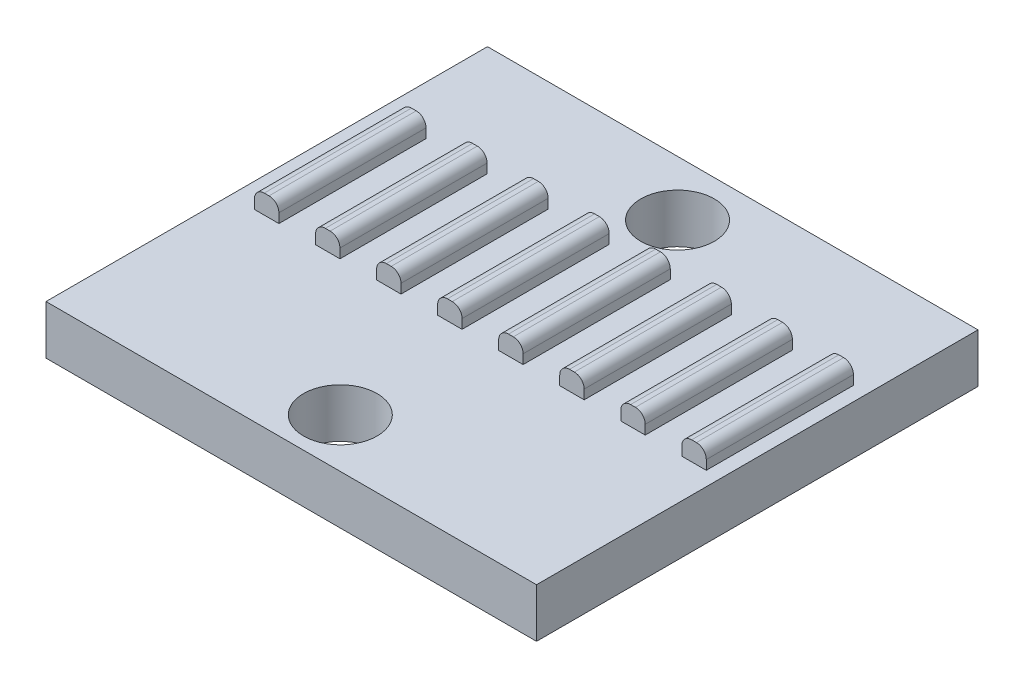
from build123d import *

# Parameters (mm, degrees)
SKETCH_1_W          = 20
SKETCH_1_H          = 18
EXTRUDE_1_DEPTH     = 2
SKETCH_6_W          = 0.995744681
SKETCH_6_H          = 6
EXTRUDE_4_DEPTH     = 0.78
EXTRUDE_4_2_DEPTH   = 0.78
SKETCH_6_W_2        = 0.99574468
EXTRUDE_4_3_DEPTH   = 0.78
EXTRUDE_4_4_DEPTH   = 0.78
EXTRUDE_4_5_DEPTH   = 0.78
EXTRUDE_4_6_DEPTH   = 0.78
EXTRUDE_4_7_DEPTH   = 0.78
EXTRUDE_4_8_DEPTH   = 0.78
FILLET_11_R         = 0.4
FILLET_12_R         = 0.4
FILLET_13_R         = 0.4
FILLET_14_R         = 0.4
FILLET_15_R         = 0.4
FILLET_16_R         = 0.4
FILLET_17_R         = 0.4
FILLET_18_R         = 0.4
FILLET_19_R         = 0.4
SKETCH_9_R          = 1.5
CUT_EXTRUDE_2_DEPTH = 10


with BuildPart() as part:
    # 草图1 → 凸台-拉伸1 (new body)
    with BuildSketch(Plane(origin=(0, 0, 0), x_dir=(1, 0, 0), z_dir=(0, 1, 0))):
        Rectangle(SKETCH_1_W, SKETCH_1_H)
    extrude(amount=EXTRUDE_1_DEPTH)

    # 草图9 → 切除-拉伸2 (cut)
    with BuildSketch(Plane(origin=(0, 2, 0), x_dir=(1, 0, 0), z_dir=(0, 1, 0))):
        with Locations(Location((0, -7, 0), (0, 0, 270))):
            Circle(SKETCH_9_R)
        with Locations(Location((0, 6.75, 0), (0, 0, 270))):
            Circle(SKETCH_9_R)
    extrude(amount=-CUT_EXTRUDE_2_DEPTH, mode=Mode.SUBTRACT)


with BuildPart() as body_2:
    # 草图6 → 凸台-拉伸4 (new body)
    with BuildSketch(Plane(origin=(0, 2, 0), x_dir=(1, 0, 0), z_dir=(0, 1, 0))):
        with Locations((8.923404255, 1.5)):
            Rectangle(SKETCH_6_W, SKETCH_6_H)
    extrude(amount=EXTRUDE_4_DEPTH)

    # 圆角19
    fillet_19_edges = [body_2.edges().sort_by_distance(p)[0] for p in [
        (8.425531915, 2.78, -1.5),
        (9.421276596, 2.78, -1.5),
    ]]
    fillet(fillet_19_edges, radius=FILLET_19_R)


with BuildPart() as body_3:
    # 草图6 → Extrude 4 2 (new body)
    with BuildSketch(Plane(origin=(0, 2, 0), x_dir=(1, 0, 0), z_dir=(0, 1, 0))):
        with Locations((6.434042554, 1.5)):
            Rectangle(SKETCH_6_W, SKETCH_6_H)
    extrude(amount=EXTRUDE_4_2_DEPTH)

    # 圆角18
    fillet_18_edges = [body_3.edges().sort_by_distance(p)[0] for p in [
        (5.936170213, 2.78, -1.5),
        (6.931914894, 2.78, -1.5),
    ]]
    fillet(fillet_18_edges, radius=FILLET_18_R)


with BuildPart() as body_4:
    # 草图6 → Extrude 4 3 (new body)
    with BuildSketch(Plane(origin=(0, 2, 0), x_dir=(1, 0, 0), z_dir=(0, 1, 0))):
        with Locations((3.944680851, 1.5)):
            Rectangle(SKETCH_6_W_2, SKETCH_6_H)
    extrude(amount=EXTRUDE_4_3_DEPTH)

    # 圆角17
    fillet_17_edges = [body_4.edges().sort_by_distance(p)[0] for p in [
        (3.446808511, 2.78, -1.5),
        (4.442553191, 2.78, -1.5),
    ]]
    fillet(fillet_17_edges, radius=FILLET_17_R)


with BuildPart() as body_5:
    # 草图6 → Extrude 4 4 (new body)
    with BuildSketch(Plane(origin=(0, 2, 0), x_dir=(1, 0, 0), z_dir=(0, 1, 0))):
        with Locations((1.455319149, 1.5)):
            Rectangle(SKETCH_6_W_2, SKETCH_6_H)
    extrude(amount=EXTRUDE_4_4_DEPTH)

    # 圆角16
    fillet_16_edges = [body_5.edges().sort_by_distance(p)[0] for p in [
        (0.957446809, 2.78, -1.5),
        (1.953191489, 2.78, -1.5),
    ]]
    fillet(fillet_16_edges, radius=FILLET_16_R)


with BuildPart() as body_6:
    # 草图6 → Extrude 4 5 (new body)
    with BuildSketch(Plane(origin=(0, 2, 0), x_dir=(1, 0, 0), z_dir=(0, 1, 0))):
        with Locations((-1.034042553, 1.5)):
            Rectangle(SKETCH_6_W, SKETCH_6_H)
    extrude(amount=EXTRUDE_4_5_DEPTH)

    # 圆角14
    fillet_14_edges = [body_6.edges().sort_by_distance(p)[0] for p in [
        (-1.531914894, 2.78, -1.5),
    ]]
    fillet(fillet_14_edges, radius=FILLET_14_R)

    # 圆角15
    fillet_15_edges = [body_6.edges().sort_by_distance(p)[0] for p in [
        (-0.536170213, 2.78, -1.5),
    ]]
    fillet(fillet_15_edges, radius=FILLET_15_R)


with BuildPart() as body_7:
    # 草图6 → Extrude 4 6 (new body)
    with BuildSketch(Plane(origin=(0, 2, 0), x_dir=(1, 0, 0), z_dir=(0, 1, 0))):
        with Locations((-3.523404256, 1.5)):
            Rectangle(SKETCH_6_W, SKETCH_6_H)
    extrude(amount=EXTRUDE_4_6_DEPTH)

    # 圆角13
    fillet_13_edges = [body_7.edges().sort_by_distance(p)[0] for p in [
        (-4.021276596, 2.78, -1.5),
        (-3.025531915, 2.78, -1.5),
    ]]
    fillet(fillet_13_edges, radius=FILLET_13_R)


with BuildPart() as body_8:
    # 草图6 → Extrude 4 7 (new body)
    with BuildSketch(Plane(origin=(0, 2, 0), x_dir=(1, 0, 0), z_dir=(0, 1, 0))):
        with Locations((-6.012765958, 1.5)):
            Rectangle(SKETCH_6_W, SKETCH_6_H)
    extrude(amount=EXTRUDE_4_7_DEPTH)

    # 圆角12
    fillet_12_edges = [body_8.edges().sort_by_distance(p)[0] for p in [
        (-6.510638298, 2.78, -1.5),
        (-5.514893617, 2.78, -1.5),
    ]]
    fillet(fillet_12_edges, radius=FILLET_12_R)


with BuildPart() as body_9:
    # 草图6 → Extrude 4 8 (new body)
    with BuildSketch(Plane(origin=(0, 2, 0), x_dir=(1, 0, 0), z_dir=(0, 1, 0))):
        with Locations((-8.50212766, 1.5)):
            Rectangle(SKETCH_6_W, SKETCH_6_H)
    extrude(amount=EXTRUDE_4_8_DEPTH)

    # 圆角11
    fillet_11_edges = [body_9.edges().sort_by_distance(p)[0] for p in [
        (-8.004255319, 2.78, -1.5),
        (-9, 2.78, -1.5),
    ]]
    fillet(fillet_11_edges, radius=FILLET_11_R)


solid = Compound([part.part, body_2.part, body_3.part, body_4.part, body_5.part, body_6.part, body_7.part, body_8.part, body_9.part])
